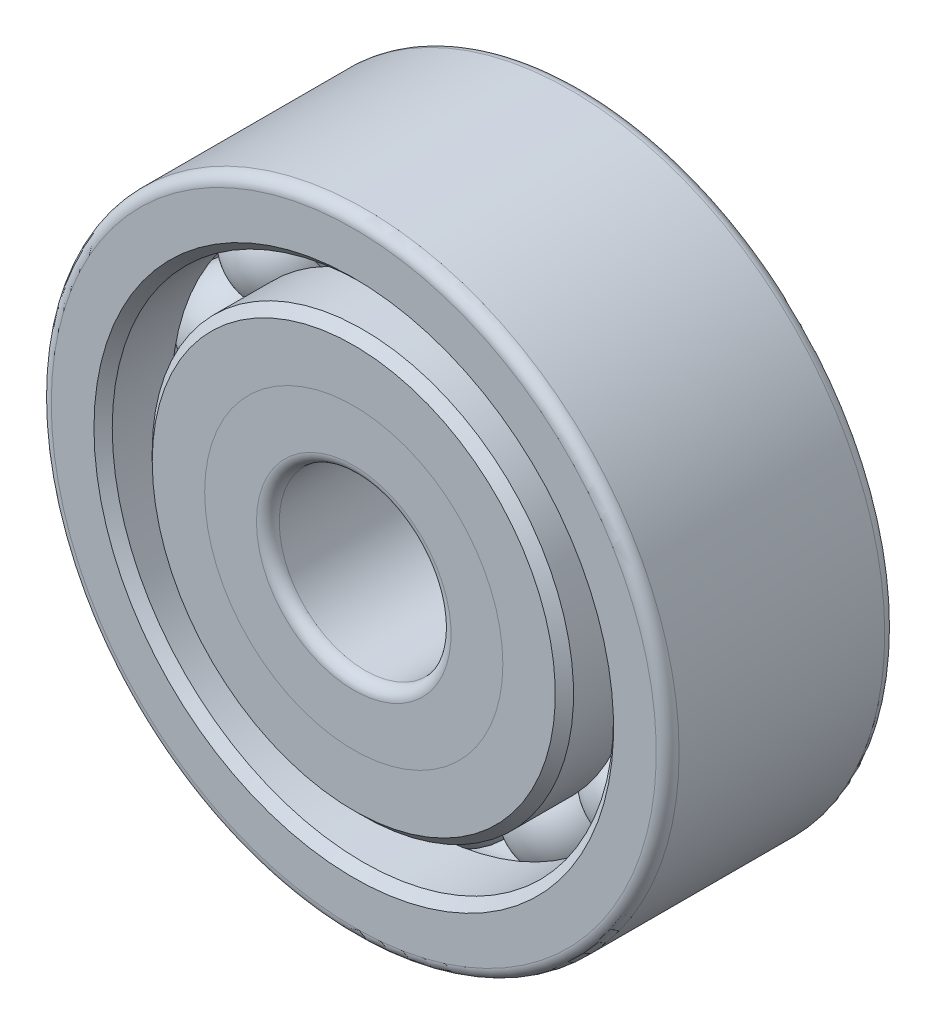
from build123d import *

# Parameters (mm, degrees)
SKETCH3_W              = 6.35
SKETCH3_H              = 3.467608
SKETCH3_H_2            = 1.758188
SKETCH4_R              = 1.38938
CIRPATTERN1_COUNT      = 14
FILLET1_R              = 0.3175
FILLET2_R              = 0.3175
CHAMFER1_SIZE          = 0.254
CHAMFER2_SIZE          = 0.254
SPLIT1_SURFACE_1_BACK  = 26.482
SPLIT1_SURFACE_1_DEPTH = 52.964
SPLIT1_SURFACE_2_BACK  = 26.482
SPLIT1_SURFACE_2_DEPTH = 52.964


with BuildPart() as part:
    # Sketch3 → Revolve2 (revolve)
    with BuildSketch(Plane(origin=(0, 0, 0), x_dir=(0, 0, -1), z_dir=(1, 0, 0)), mode=Mode.PRIVATE) as revolve2_sk:
        with Locations((0, 4.121404)):
            Rectangle(SKETCH3_W, SKETCH3_H)
        with Locations((0, 7.845806)):
            Rectangle(SKETCH3_W, SKETCH3_H_2)
    revolve(revolve2_sk.sketch.rotate(Axis((0, 0, 3.175), (0, 0, -1)), 90), axis=Axis((0, 0, 3.175), (0, 0, -1)))

    # Sketch4 → Cut-Revolve1 (revolve, cut)
    with BuildSketch(Plane(origin=(0, 0, 0), x_dir=(0, 0, -1), z_dir=(1, 0, 0)), mode=Mode.PRIVATE) as cut_revolve1_sk:
        with Locations((0, 6.41096)):
            Circle(SKETCH4_R)
    revolve(cut_revolve1_sk.sketch.rotate(Axis((0, 0, 3.175), (0, 0, -1)), 90), axis=Axis((0, 0, 3.175), (0, 0, -1)), mode=Mode.SUBTRACT)

    # Fillet1
    fillet1_edges = [part.edges().sort_by_distance(p)[0] for p in [
        (-8.7249, 0, -3.175),
        (-8.7249, 0, 3.175),
    ]]
    fillet(fillet1_edges, radius=FILLET1_R)

    # Fillet2
    fillet2_edges = [part.edges().sort_by_distance(p)[0] for p in [
        (-2.3876, 0, 3.175),
        (-2.3876, 0, -3.175),
    ]]
    fillet(fillet2_edges, radius=FILLET2_R)

    # Chamfer1
    chamfer1_edges = [part.edges().sort_by_distance(p)[0] for p in [
        (-6.966712, 0, -3.175),
        (-6.966712, 0, 3.175),
    ]]
    chamfer(chamfer1_edges, length=CHAMFER1_SIZE)

    # Chamfer2
    chamfer2_edges = [part.edges().sort_by_distance(p)[0] for p in [
        (-5.855208, 0, 3.175),
        (-5.855208, 0, -3.175),
    ]]
    chamfer(chamfer2_edges, length=CHAMFER2_SIZE)


with BuildPart() as body_2:
    # Sketch5 → Revolve3 (revolve)
    with BuildSketch(Plane(origin=(0, 0, 0), x_dir=(0, 0, -1), z_dir=(1, 0, 0))):
        with BuildLine():
            Line((-1.38938, 6.41096), (1.38938, 6.41096))
            ThreePointArc((1.38938, 6.41096), (0, 7.80034), (-1.38938, 6.41096))
        make_face()
    revolve(axis=Axis((0, 6.41096, 1.38938), (0, 0, -1)))


with BuildPart() as cirpattern1_1:
    # CirPattern1: pattern copy
    add(body_2.part.rotate(Axis((0, 0, 0), (0, 0, 1)), 1 * 360 / CIRPATTERN1_COUNT))


with BuildPart() as cirpattern1_2:
    # CirPattern1: pattern copy
    add(body_2.part.rotate(Axis((0, 0, 0), (0, 0, 1)), 2 * 360 / CIRPATTERN1_COUNT))


with BuildPart() as cirpattern1_3:
    # CirPattern1: pattern copy
    add(body_2.part.rotate(Axis((0, 0, 0), (0, 0, 1)), 3 * 360 / CIRPATTERN1_COUNT))


with BuildPart() as cirpattern1_4:
    # CirPattern1: pattern copy
    add(body_2.part.rotate(Axis((0, 0, 0), (0, 0, 1)), 4 * 360 / CIRPATTERN1_COUNT))


with BuildPart() as cirpattern1_5:
    # CirPattern1: pattern copy
    add(body_2.part.rotate(Axis((0, 0, 0), (0, 0, 1)), 5 * 360 / CIRPATTERN1_COUNT))


with BuildPart() as cirpattern1_6:
    # CirPattern1: pattern copy
    add(body_2.part.rotate(Axis((0, 0, 0), (0, 0, 1)), 6 * 360 / CIRPATTERN1_COUNT))


with BuildPart() as cirpattern1_7:
    # CirPattern1: pattern copy
    add(body_2.part.rotate(Axis((0, 0, 0), (0, 0, 1)), 7 * 360 / CIRPATTERN1_COUNT))


with BuildPart() as cirpattern1_8:
    # CirPattern1: pattern copy
    add(body_2.part.rotate(Axis((0, 0, 0), (0, 0, 1)), 8 * 360 / CIRPATTERN1_COUNT))


with BuildPart() as cirpattern1_9:
    # CirPattern1: pattern copy
    add(body_2.part.rotate(Axis((0, 0, 0), (0, 0, 1)), 9 * 360 / CIRPATTERN1_COUNT))


with BuildPart() as cirpattern1_10:
    # CirPattern1: pattern copy
    add(body_2.part.rotate(Axis((0, 0, 0), (0, 0, 1)), 10 * 360 / CIRPATTERN1_COUNT))


with BuildPart() as cirpattern1_11:
    # CirPattern1: pattern copy
    add(body_2.part.rotate(Axis((0, 0, 0), (0, 0, 1)), 11 * 360 / CIRPATTERN1_COUNT))


with BuildPart() as cirpattern1_12:
    # CirPattern1: pattern copy
    add(body_2.part.rotate(Axis((0, 0, 0), (0, 0, 1)), 12 * 360 / CIRPATTERN1_COUNT))


with BuildPart() as cirpattern1_13:
    # CirPattern1: pattern copy
    add(body_2.part.rotate(Axis((0, 0, 0), (0, 0, 1)), 13 * 360 / CIRPATTERN1_COUNT))


with BuildPart() as body_16:
    # Split1: the piece behind the surface
    add(part.part)
    # Split1 surface: a surface, the sketch's curves swept straight by 52.964 mm
    with BuildLine(Plane.XY.offset(-SPLIT1_SURFACE_1_BACK), mode=Mode.PRIVATE) as split1_surface_1_path:
        CenterArc((0, 0), 4.143586667, 0, 360)
    split1_surface_1 = Shell.extrude(split1_surface_1_path.wire(), (0 * SPLIT1_SURFACE_1_DEPTH, 0 * SPLIT1_SURFACE_1_DEPTH, 1 * SPLIT1_SURFACE_1_DEPTH))
    split(bisect_by=split1_surface_1, keep=Keep.BOTTOM)


with BuildPart() as part_1:
    add(part.part)

    # Split1: split by a surface, the side it looks to stays
    # Split1 surface: a surface, the sketch's curves swept straight by 52.964 mm
    with BuildLine(Plane.XY.offset(-SPLIT1_SURFACE_2_BACK), mode=Mode.PRIVATE) as split1_surface_2_path:
        CenterArc((0, 0), 4.143586667, 0, 360)
    split1_surface_2 = Shell.extrude(split1_surface_2_path.wire(), (0 * SPLIT1_SURFACE_2_DEPTH, 0 * SPLIT1_SURFACE_2_DEPTH, 1 * SPLIT1_SURFACE_2_DEPTH))
    split(bisect_by=split1_surface_2, keep=Keep.TOP)


solid = Compound([body_2.part, cirpattern1_1.part, cirpattern1_2.part, cirpattern1_3.part, cirpattern1_4.part, cirpattern1_5.part, cirpattern1_6.part, cirpattern1_7.part, cirpattern1_8.part, cirpattern1_9.part, cirpattern1_10.part, cirpattern1_11.part, cirpattern1_12.part, cirpattern1_13.part, body_16.part, part_1.part])
